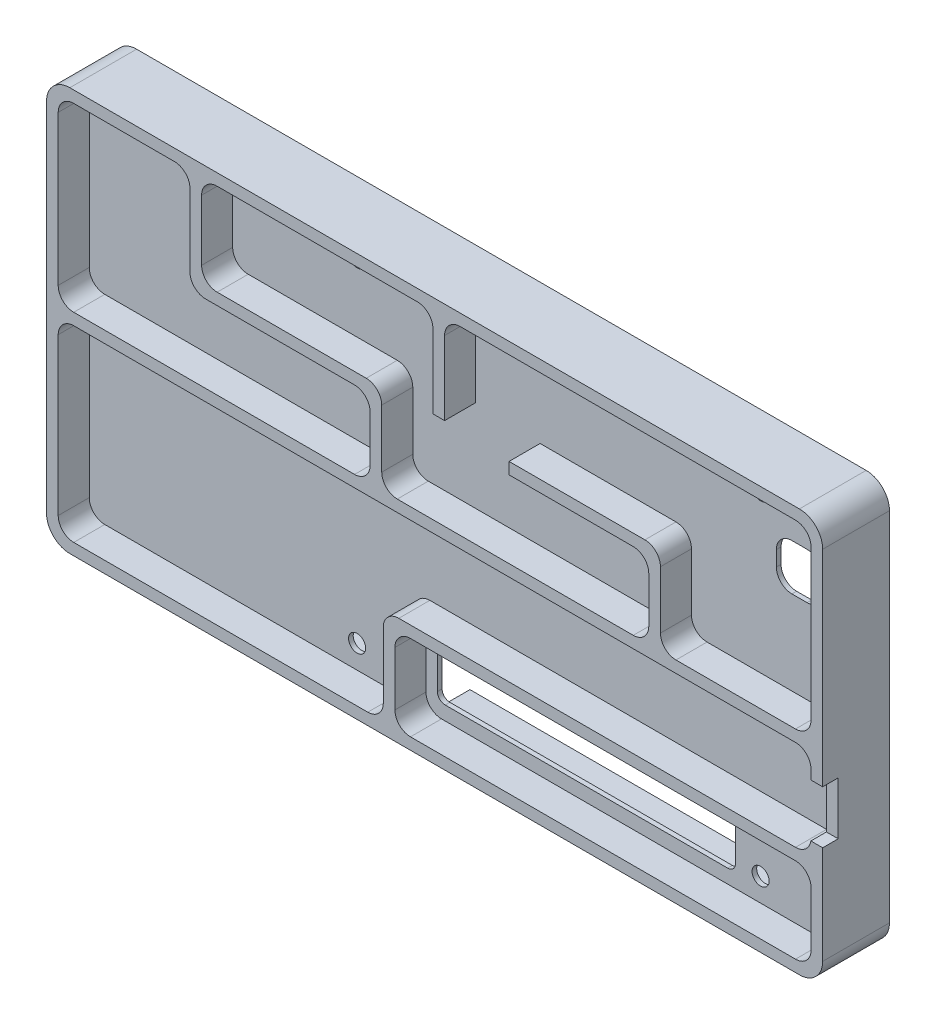
from build123d import *

# Parameters (mm, degrees)
SKETCH_1_W           = 99.974800609
SKETCH_1_H           = 51.97470409
EXTRUDE_1_DEPTH      = 8.6
SKETCH_2_W           = 95.974800609
SKETCH_2_H           = 47.97470409
CUT_EXTRUDE_1_DEPTH  = 4
SKETCH_3_W           = 2
SKETCH_3_H           = 10
SKETCH_3_H_2         = 9.97470409
CUT_EXTRUDE_2_DEPTH  = 3.35
SKETCH_4_R           = 1.1
SKETCH_4_W           = 38.392586289
SKETCH_4_H           = 7.4
SKETCH_4_W_2         = 5.95
SKETCH_4_H_2         = 5.95
CUT_EXTRUDE_3_DEPTH  = 1437.448457956
SKETCH_6_W           = 6.76
SKETCH_6_H           = 6.795709929
CUT_EXTRUDE_4_DEPTH  = 4.5
FILLET_1_R           = 3
FILLET_3_R           = 2
SKETCH_12_W          = 9.000025401
SKETCH_12_H          = 9.0000508
EXTRUDE_3_DEPTH      = 2.7
SKETCH_13_W          = 16.992125984
SKETCH_13_H          = 17.047314393
EXTRUDE_4_DEPTH      = 1.9
SKETCH_7_W           = 53.6
SKETCH_7_H           = 10.97470409
CUT_EXTRUDE_14_DEPTH = 4
FILLET_7_R           = 2
FILLET_8_R           = 1
SKETCH_14_W          = 2.323736835
SKETCH_14_H          = 6.8
CUT_EXTRUDE_15_DEPTH = 2


with BuildPart() as part:
    # 草图1 → 凸台-拉伸1 (new body)
    with BuildSketch(Plane.XY.offset(1046.483288979)):
        with Locations((934.375963031, 1020.144466268)):
            Rectangle(SKETCH_1_W, SKETCH_1_H)
    extrude(amount=EXTRUDE_1_DEPTH)

    # 草图2 → 切除-拉伸1 (cut)
    with BuildSketch(Plane(origin=(0, 0, 1046.483288979), x_dir=(-1, 0, 0), z_dir=(0, 0, -1))):
        with Locations((-934.375963031, 1020.144466268)):
            Rectangle(SKETCH_2_W, SKETCH_2_H)
    extrude(amount=-CUT_EXTRUDE_1_DEPTH, mode=Mode.SUBTRACT)

    # 草图3 → 切除-拉伸2 (cut)
    with BuildSketch(Plane(origin=(0, 0, 1046.483288979), x_dir=(-1, 0, 0), z_dir=(0, 0, -1))):
        with Locations((-885.388562726, 1034.131818313)):
            Rectangle(SKETCH_3_W, SKETCH_3_H)
        with Locations((-885.388562726, 1020.144466268)):
            Rectangle(SKETCH_3_W, SKETCH_3_H_2)
        with Locations((-885.388562726, 1006.157114223)):
            Rectangle(SKETCH_3_W, SKETCH_3_H)
    extrude(amount=-CUT_EXTRUDE_2_DEPTH, mode=Mode.SUBTRACT)

    # 草图4 → 切除-拉伸3 (cut, through all)
    with BuildSketch(Plane(origin=(0, 0, 1050.483288979), x_dir=(-1, 0, 0), z_dir=(0, 0, -1))):
        with Locations((-920.388562726, 1041.631818313)):
            Circle(SKETCH_4_R)
        with Locations((-920.388562726, 998.657114223)):
            Circle(SKETCH_4_R)
        with Locations((-972.363363335, 998.657114223)):
            Circle(SKETCH_4_R)
        with Locations((-972.363363335, 1041.631818313)):
            Circle(SKETCH_4_R)
        with Locations((-949.933821712, 1001.144429438)):
            Rectangle(SKETCH_4_W, SKETCH_4_H)
        with Locations((-977.376048121, 1035.144495478)):
            Rectangle(SKETCH_4_W_2, SKETCH_4_H_2)
    extrude(amount=-CUT_EXTRUDE_3_DEPTH, mode=Mode.SUBTRACT)

    # 草图6 → 切除-拉伸4 (cut)
    with BuildSketch(Plane(origin=(0, 0, 1046.483288979), x_dir=(-1, 0, 0), z_dir=(0, 0, -1))):
        with Locations((-926.946347841, 997.554969188)):
            Rectangle(SKETCH_6_W, SKETCH_6_H)
    extrude(amount=-CUT_EXTRUDE_4_DEPTH, mode=Mode.SUBTRACT)

    # 圆角1
    fillet_1_edges = [part.edges().sort_by_distance(p)[0] for p in [
        (884.388562726, 1046.131818313, 1050.783288979),
        (984.363363335, 1046.131818313, 1050.783288979),
        (984.363363335, 994.157114223, 1050.783288979),
        (884.388562726, 994.157114223, 1050.783288979),
    ]]
    fillet(fillet_1_edges, radius=FILLET_1_R)

    # 圆角3
    fillet_3_edges = [part.edges().sort_by_distance(p)[0] for p in [
        (980.351048121, 1032.169495478, 1052.783288979),
        (980.351048121, 1038.119495478, 1052.783288979),
        (974.401048121, 1038.119495478, 1052.783288979),
        (974.401048121, 1032.169495478, 1052.783288979),
    ]]
    fillet(fillet_3_edges, radius=FILLET_3_R)

    # 草图12 → 凸台-拉伸3 (add)
    with BuildSketch(Plane(origin=(0, 0, 1050.483288979), x_dir=(-1, 0, 0), z_dir=(0, 0, -1))):
        with Locations((-955.369926709, 1022.842410134)):
            Rectangle(SKETCH_12_W, SKETCH_12_H)
    extrude(amount=EXTRUDE_3_DEPTH)

    # 草图13 → 凸台-拉伸4 (add)
    with BuildSketch(Plane(origin=(0, 0, 1050.483288979), x_dir=(-1, 0, 0), z_dir=(0, 0, -1))):
        with Locations((-935.979052947, 1018.778239857)):
            Rectangle(SKETCH_13_W, SKETCH_13_H)
    extrude(amount=EXTRUDE_4_DEPTH)

    # 草图7 → 切除-拉伸14 (cut)
    with BuildSketch(Plane.XY.offset(1055.083288979)):
        Polygon((885.888562726, 1019.831818313), (982.863363335, 1019.831818313), (982.863363335, 1008.131818313), (927.763363335, 1008.131818313), (927.763363335, 1006.631818313), (927.763363335, 995.657114223), (885.888562726, 995.657114223), align=None)
        Polygon((934.163363335, 1044.631818313), (934.163363335, 1033.131818313), (935.663363335, 1033.131818313), (935.663363335, 1044.631818313), (982.863363335, 1044.631818313), (982.863363335, 1021.331818313), (963.463363335, 1021.331818313), (963.463363335, 1032.731818313), (943.963363335, 1032.731818313), (943.963363335, 1031.231818313), (961.963363335, 1031.231818313), (961.963363335, 1021.331818313), (927.563363335, 1021.331818313), (927.563363335, 1032.811818313), (904.363363335, 1032.811818313), (904.363363335, 1044.631818313), align=None)
        with Locations((956.063363335, 1001.144466268)):
            Rectangle(SKETCH_7_W, SKETCH_7_H)
        Polygon((926.063363335, 1021.331818313), (926.063363335, 1031.311818313), (902.863363335, 1031.311818313), (902.863363335, 1044.631818313), (885.888562726, 1044.631818313), (885.888562726, 1021.331818313), align=None)
    extrude(amount=-CUT_EXTRUDE_14_DEPTH, mode=Mode.SUBTRACT)

    # 圆角7
    fillet_7_edges = [part.edges().sort_by_distance(p)[0] for p in [
        (923.566347841, 1000.952824152, 1050.733288979),
        (930.326347841, 1000.952824152, 1050.733288979),
        (982.363363335, 996.157114223, 1048.483288979),
        (982.363363335, 1044.131818313, 1048.483288979),
        (886.388562726, 1044.131818313, 1048.483288979),
        (886.388562726, 996.157114223, 1048.483288979),
        (982.863363335, 995.657114223, 1053.083288979),
        (929.263363335, 995.657114223, 1053.083288979),
        (929.263363335, 1006.631818313, 1053.083288979),
        (982.863363335, 1006.631818313, 1053.083288979),
        (961.963363335, 1021.331818313, 1053.083288979),
        (927.563363335, 1021.331818313, 1053.083288979),
        (927.563363335, 1032.811818313, 1053.083288979),
        (904.363363335, 1032.811818313, 1053.083288979),
        (904.363363335, 1044.631818313, 1053.083288979),
        (934.163363335, 1044.631818313, 1053.083288979),
        (935.663363335, 1044.631818313, 1053.083288979),
        (982.863363335, 1044.631818313, 1053.083288979),
        (982.863363335, 1021.331818313, 1053.083288979),
        (963.463363335, 1021.331818313, 1053.083288979),
        (963.463363335, 1032.731818313, 1053.083288979),
        (961.963363335, 1031.231818313, 1053.083288979),
        (885.888562726, 1021.331818313, 1053.083288979),
        (885.888562726, 1044.631818313, 1053.083288979),
        (902.863363335, 1044.631818313, 1053.083288979),
        (902.863363335, 1031.311818313, 1053.083288979),
        (926.063363335, 1031.311818313, 1053.083288979),
        (926.063363335, 1021.331818313, 1053.083288979),
        (927.763363335, 995.657114223, 1053.083288979),
        (885.888562726, 995.657114223, 1053.083288979),
        (885.888562726, 1019.831818313, 1053.083288979),
        (982.863363335, 1019.831818313, 1053.083288979),
        (982.863363335, 1008.131818313, 1053.083288979),
        (927.763363335, 1008.131818313, 1053.083288979),
    ]]
    fillet(fillet_7_edges, radius=FILLET_7_R)

    # 圆角8
    fillet_8_edges = [part.edges().sort_by_distance(p)[0] for p in [
        (930.737528567, 997.444429438, 1050.783288979),
        (969.130114856, 997.444429438, 1050.783288979),
        (930.737528567, 1004.844429438, 1050.783288979),
        (969.130114856, 1004.844429438, 1050.783288979),
    ]]
    fillet(fillet_8_edges, radius=FILLET_8_R)

    # 草图14 → 切除-拉伸15 (cut)
    with BuildSketch(Plane.XY.offset(1055.083288979)):
        with Locations((983.201494917, 1013.231818313)):
            Rectangle(SKETCH_14_W, SKETCH_14_H)
    extrude(amount=-CUT_EXTRUDE_15_DEPTH, mode=Mode.SUBTRACT)


solid = part.part
